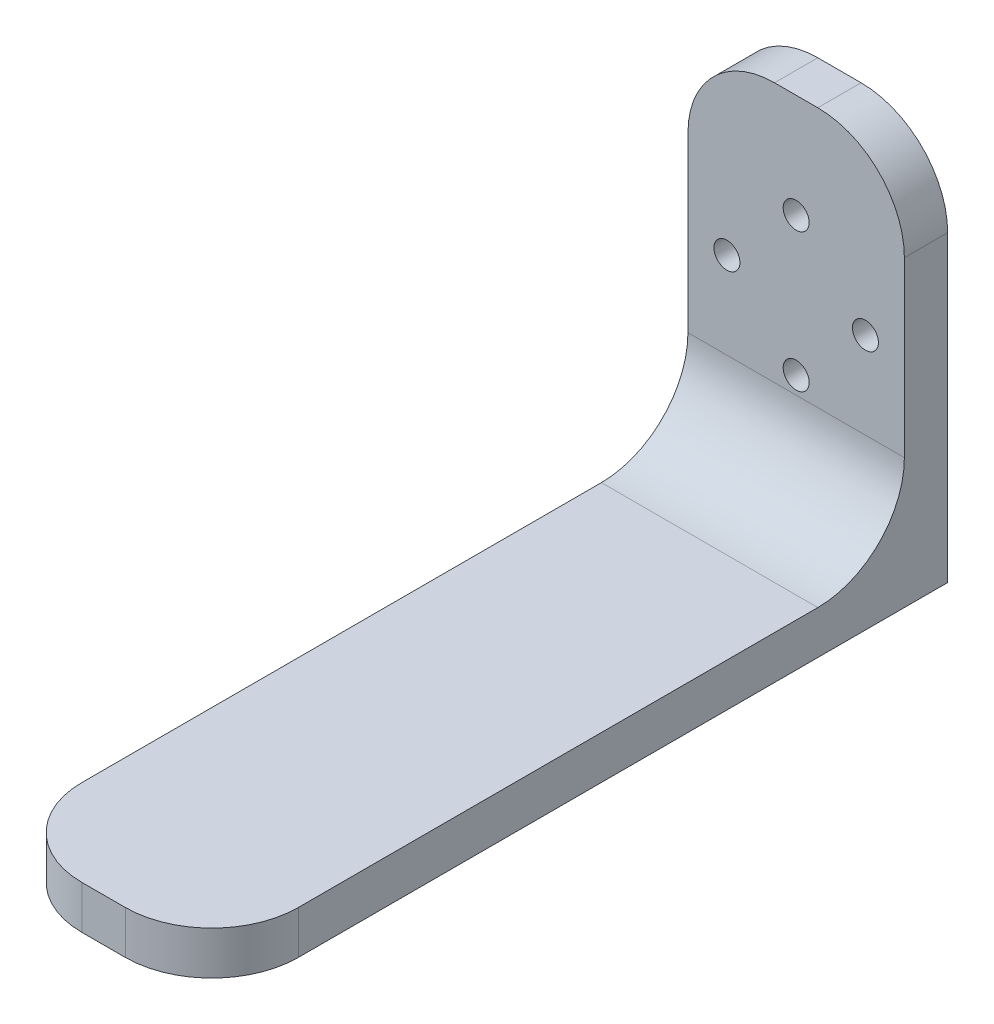
from build123d import *

# Parameters (mm, degrees)
SKETCH_1_W      = 25
SKETCH_1_H      = 40
SKETCH_1_R      = 1.5
EXTRUDE_1_DEPTH = 5
SKETCH_2_W      = 25
SKETCH_2_H      = 85
EXTRUDE_2_DEPTH = 5
FILLET_1_R      = 10


with BuildPart() as part:
    # 草图1 → 凸台-拉伸1 (new body)
    with BuildSketch(Plane.XY):
        Rectangle(SKETCH_1_W, SKETCH_1_H)
        with Locations((0, 8)):
            Circle(SKETCH_1_R, mode=Mode.SUBTRACT)
        with Locations((8, 0)):
            Circle(SKETCH_1_R, mode=Mode.SUBTRACT)
        with Locations((0, -8)):
            Circle(SKETCH_1_R, mode=Mode.SUBTRACT)
        with Locations((-8, 0)):
            Circle(SKETCH_1_R, mode=Mode.SUBTRACT)
    extrude(amount=EXTRUDE_1_DEPTH)

    # 草图2 → 凸台-拉伸2 (add)
    with BuildSketch(Plane.XZ.offset(20)):
        with Locations((0, 42.5)):
            Rectangle(SKETCH_2_W, SKETCH_2_H)
    extrude(amount=EXTRUDE_2_DEPTH)

    # 圆角1
    fillet_1_edges = [part.edges().sort_by_distance(p)[0] for p in [
        (-12.5, -22.5, 85),
        (12.5, -22.5, 85),
        (-12.5, 20, 2.5),
        (12.5, 20, 2.5),
        (0, -20, 5),
    ]]
    fillet(fillet_1_edges, radius=FILLET_1_R)


solid = part.part
